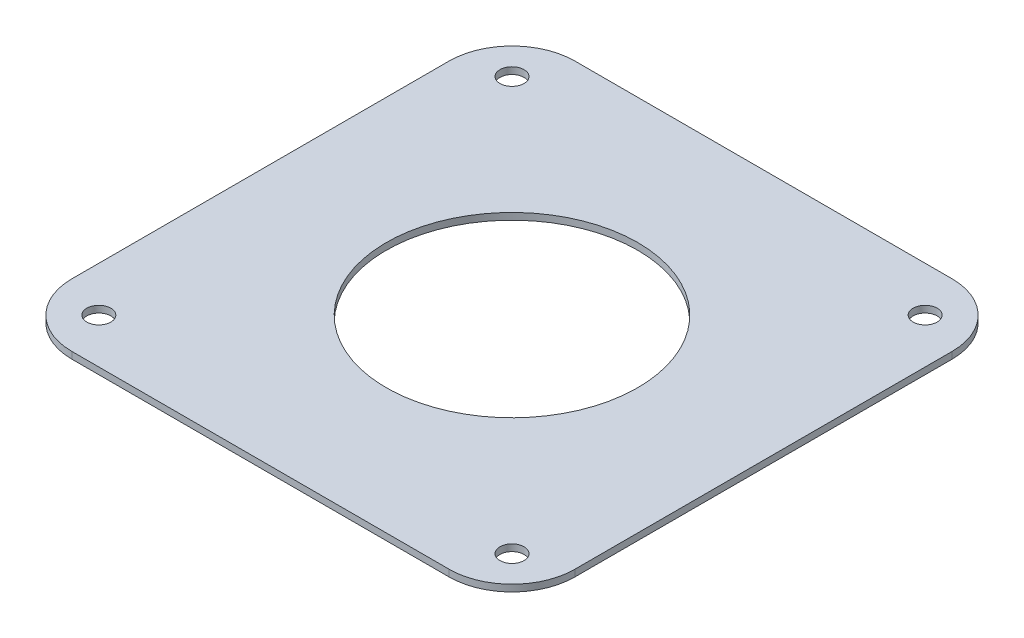
from build123d import *

# Parameters (mm, degrees)
SKETCH1_W            = 71.12
SKETCH1_H            = 71.12
SKETCH1_R            = 17.78
BOSS_EXTRUDE1_DEPTH  = 0.9525
FILLET1_R            = 8.89
M3_CLEARANCE_HOLE1_D = 3.4


with BuildPart() as part:
    # Sketch1 → Boss-Extrude1 (new body)
    with BuildSketch(Plane(origin=(0, 0, 0), x_dir=(1, 0, 0), z_dir=(0, 1, 0))):
        Rectangle(SKETCH1_W, SKETCH1_H)
        with Locations(Location((0, 0, 0), (0, 0, 90))):
            Circle(SKETCH1_R, mode=Mode.SUBTRACT)
    extrude(amount=BOSS_EXTRUDE1_DEPTH)

    # Fillet1
    fillet1_edges = [part.edges().sort_by_distance(p)[0] for p in [
        (35.56, 0.47625, 35.56),
        (-35.56, 0.47625, 35.56),
        (-35.56, 0.47625, -35.56),
        (35.56, 0.47625, -35.56),
    ]]
    fillet(fillet1_edges, radius=FILLET1_R)

    # M3 Clearance Hole1 (through all)
    with Locations(Plane(origin=(0, 0.9525, 0), x_dir=(1, 0, 0), z_dir=(0, 1, 0))):
        with Locations((-29.21, -29.21), (29.21, -29.21), (29.21, 29.21), (-29.21, 29.21)):
            Hole(M3_CLEARANCE_HOLE1_D / 2)


solid = part.part
